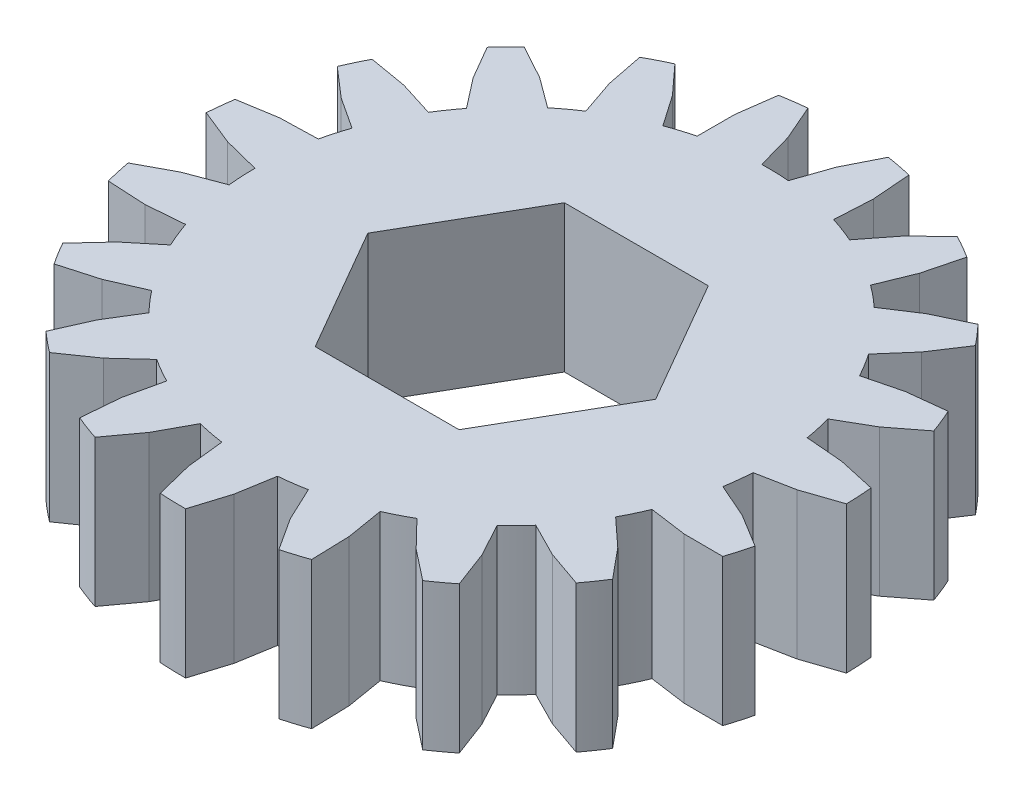
from build123d import *

# Parameters (mm, degrees)
BOSS_EXTRUDE1_DEPTH      = 2.5
BOSS_EXTRUDE1_DEPTH_BACK = 2.5
SKETCH3_R                = 11.25
CUT_EXTRUDE1_DEPTH       = 17.105123408
CUT_EXTRUDE1_DEPTH_BACK  = 17.105123408
CUT_EXTRUDE2_DEPTH       = 17.676263216


with BuildPart() as part:
    # Sketch3 → Boss-Extrude1 (new, two sides: drawn at the far end of the back side and taken through both)
    with BuildSketch(Plane(origin=(0, 0, 0), x_dir=(1, 0, 0), z_dir=(0, 1, 0)).offset(-BOSS_EXTRUDE1_DEPTH_BACK)):
        Circle(SKETCH3_R)
    extrude(amount=BOSS_EXTRUDE1_DEPTH + BOSS_EXTRUDE1_DEPTH_BACK)

    # Sketch1 → Cut-Extrude1 (cut, two sides: drawn at the far end of the back side and taken through both)
    with BuildSketch(Plane(origin=(0, 0, 0), x_dir=(1, 0, 0), z_dir=(0, 1, 0)).offset(-CUT_EXTRUDE1_DEPTH_BACK)):
        with BuildLine():
            Line((1.131858911, 9.935738292), (0.713336296, 8.720874459))
            ThreePointArc((0.713336296, 8.720874459), (0.24791183, 8.746487279), (-0.218216182, 8.747278531))
            Line((-0.218216182, 8.747278531), (-0.567253557, 9.983898207))
            Line((-0.567253557, 9.983898207), (-1.093414937, 11.196738086))
            ThreePointArc((-1.093414937, 11.196738086), (0.318743782, 11.245483645), (1.725874204, 11.116827705))
            Line((1.725874204, 11.116827705), (1.131858911, 9.935738292))
        make_face()
        with BuildLine():
            Line((4.296660623, 9.029878598), (3.506349076, 8.016733509))
            ThreePointArc((3.506349076, 8.016733509), (3.074459061, 8.192081633), (2.633844069, 8.344181531))
            Line((2.633844069, 8.344181531), (2.705248253, 9.627129992))
            Line((2.705248253, 9.627129992), (2.601404214, 10.945099182))
            ThreePointArc((2.601404214, 10.945099182), (3.952875935, 10.532676386), (5.241989634, 9.954096879))
            Line((5.241989634, 9.954096879), (4.296660623, 9.029878598))
        make_face()
        with BuildLine():
            Line((6.995852487, 7.145491445), (5.919394526, 6.443855092))
            ThreePointArc((5.919394526, 6.443855092), (5.567840946, 6.749936829), (5.200486446, 7.036862989))
            Line((5.200486446, 7.036862989), (5.684594439, 8.227112863))
            Line((5.684594439, 8.227112863), (6.014320853, 9.507388951))
            ThreePointArc((6.014320853, 9.507388951), (7.158652645, 8.678490209), (8.19005415, 7.712685202))
            Line((8.19005415, 7.712685202), (6.995852487, 7.145491445))
        make_face()
        with BuildLine():
            Line((8.936935181, 4.48677942), (7.690981731, 4.172684988))
            ThreePointArc((7.690981731, 4.172684988), (7.457860872, 4.576331633), (7.203575423, 4.966991153))
            Line((7.203575423, 4.966991153), (8.047926613, 5.935560398))
            Line((8.047926613, 5.935560398), (8.775492506, 7.039405605))
            ThreePointArc((8.775492506, 7.039405605), (9.588678264, 5.883854957), (10.250599217, 4.635484408))
            Line((10.250599217, 4.635484408), (8.936935181, 4.48677942))
        make_face()
        with BuildLine():
            Line((9.909562279, 1.341855225), (8.629131728, 1.44933972))
            ThreePointArc((8.629131728, 1.44933972), (8.539705851, 1.906809896), (8.426045228, 2.358868756))
            Line((8.426045228, 2.358868756), (9.539141061, 3.000797864))
            Line((9.539141061, 3.000797864), (10.58570338, 3.808593434))
            ThreePointArc((10.58570338, 3.808593434), (10.979621808, 2.451612724), (11.200332804, 1.055956952))
            Line((11.200332804, 1.055956952), (9.909562279, 1.341855225))
        make_face()
        with BuildLine():
            Line((9.80833454, -1.948479804), (8.632181407, -1.431063996))
            ThreePointArc((8.632181407, -1.431063996), (8.696141194, -0.96934428), (8.735422289, -0.504873673))
            Line((8.735422289, -0.504873673), (9.99664156, -0.25914768))
            Line((9.99664156, -0.25914768), (11.248789039, 0.165061068))
            ThreePointArc((11.248789039, 0.165061068), (11.180752964, -1.246299789), (10.936336541, -2.637999824))
            Line((10.936336541, -2.637999824), (9.80833454, -1.948479804))
        make_face()
        with BuildLine():
            Line((8.644221562, -5.027666813), (7.699800288, -4.156389722))
            ThreePointArc((7.699800288, -4.156389722), (7.910214704, -3.740454963), (8.098180801, -3.313905205))
            Line((8.098180801, -3.313905205), (9.370850832, -3.491010552))
            Line((9.370850832, -3.491010552), (10.692893862, -3.496358227))
            ThreePointArc((10.692893862, -3.496358227), (10.170276048, -4.809156382), (9.487218518, -6.046088387))
            Line((9.487218518, -6.046088387), (8.644221562, -5.027666813))
        make_face()
        with BuildLine():
            Line((6.543373049, -7.56202811), (5.933026334, -6.431306129))
            ThreePointArc((5.933026334, -6.431306129), (6.267093712, -6.106229312), (6.583375767, -5.763823688))
            Line((6.583375767, -5.763823688), (7.729583013, -6.344568263))
            Line((7.729583013, -6.344568263), (8.978257718, -6.778892855))
            ThreePointArc((8.978257718, -6.778892855), (8.057691915, -7.850866258), (7.01001316, -8.798989458))
            Line((7.01001316, -8.798989458), (6.543373049, -7.56202811))
        make_face()
        with BuildLine():
            Line((3.733448535, -9.276926325), (3.523316916, -8.009290725))
            ThreePointArc((3.523316916, -8.009290725), (3.944835871, -7.810298967), (4.355159817, -7.58914244))
            Line((4.355159817, -7.58914244), (5.250694938, -8.510593556))
            Line((5.250694938, -8.510593556), (6.290688039, -9.326829258))
            ThreePointArc((6.290688039, -9.326829258), (5.071931835, -10.041812957), (3.773164105, -10.598383492))
            Line((3.773164105, -10.598383492), (3.733448535, -9.276926325))
        make_face()
        with BuildLine():
            Line((0.518946942, -9.986525626), (0.73180144, -8.719344394))
            ThreePointArc((0.73180144, -8.719344394), (1.195093854, -8.668001539), (1.654994723, -8.59205985))
            Line((1.654994723, -8.59205985), (2.202812593, -9.754363981))
            Line((2.202812593, -9.754363981), (2.9214247, -10.864058989))
            ThreePointArc((2.9214247, -10.864058989), (1.536549241, -11.144573407), (0.127434172, -11.249278223))
            Line((0.127434172, -11.249278223), (0.518946942, -9.986525626))
        make_face()
        with BuildLine():
            Line((-2.751790604, -9.613929918), (-2.139016077, -8.484521803))
            ThreePointArc((-2.139016077, -8.484521803), (-1.684155126, -8.586391647), (-1.224514728, -8.663894256))
            Line((-1.224514728, -8.663894256), (-1.083778676, -9.941097715))
            Line((-1.083778676, -9.941097715), (-0.764420336, -11.223999356))
            ThreePointArc((-0.764420336, -11.223999356), (-2.165342305, -11.039646403), (-3.532105231, -10.681139108))
            Line((-3.532105231, -10.681139108), (-2.751790604, -9.613929918))
        make_face()
        with BuildLine():
            Line((-5.72432894, -8.199515729), (-4.778038012, -7.330269624))
            ThreePointArc((-4.778038012, -7.330269624), (-4.380899766, -7.574312988), (-3.971329009, -7.796861285))
            Line((-3.971329009, -7.796861285), (-4.25292571, -9.050559259))
            Line((-4.25292571, -9.050559259), (-4.367428567, -10.367645235))
            ThreePointArc((-4.367428567, -10.367645235), (-5.632585414, -9.738402413), (-6.808886226, -8.955532836))
            Line((-6.808886226, -8.955532836), (-5.72432894, -8.199515729))
        make_face()
        with BuildLine():
            Line((-8.076547414, -5.896556781), (-6.899285389, -5.38166899))
            ThreePointArc((-6.899285389, -5.38166899), (-6.60290594, -5.741439989), (-6.28778817, -6.084917413))
            Line((-6.28778817, -6.084917413), (-6.961202251, -7.179252274))
            Line((-6.961202251, -7.179252274), (-7.497158145, -8.387795881))
            ThreePointArc((-7.497158145, -8.387795881), (-8.489450494, -7.381851415), (-9.347818747, -6.259455621))
            Line((-9.347818747, -6.259455621), (-8.076547414, -5.896556781))
        make_face()
        with BuildLine():
            Line((-9.553546654, -2.954614412), (-8.272888141, -2.849881016))
            ThreePointArc((-8.272888141, -2.849881016), (-8.1093848, -3.28639288), (-7.922867918, -3.713578323))
            Line((-7.922867918, -3.713578323), (-8.915124515, -4.529961907))
            Line((-8.915124515, -4.529961907), (-9.814454308, -5.498998694))
            ThreePointArc((-9.814454308, -5.498998694), (-10.426351886, -4.225362275), (-10.873770061, -2.885069265))
            Line((-10.873770061, -2.885069265), (-9.553546654, -2.954614412))
        make_face()
        with BuildLine():
            Line((-9.995270876, 0.307506274), (-8.749995096, -0.009264214))
            ThreePointArc((-8.749995096, -0.009264214), (-8.737085987, -0.475214109), (-8.69938199, -0.939815399))
            Line((-8.69938199, -0.939815399), (-9.902954705, -1.389779878))
            Line((-9.902954705, -1.389779878), (-11.068202059, -2.014299673))
            ThreePointArc((-11.068202059, -2.014299673), (-11.233396269, -0.610989569), (-11.221379665, 0.801959113))
            Line((-11.221379665, 0.801959113), (-9.995270876, 0.307506274))
        make_face()
        with BuildLine():
            Line((-9.353852406, 3.536303884), (-8.278904312, 2.83235651))
            ThreePointArc((-8.278904312, 2.83235651), (-8.417988338, 2.387461485), (-8.53318304, 1.935791107))
            Line((-8.53318304, 1.935791107), (-9.817646093, 1.901006365))
            Line((-9.817646093, 1.901006365), (-11.122538377, 1.688679973))
            ThreePointArc((-11.122538377, 1.688679973), (-10.823127863, 3.069593338), (-10.352978664, 4.402082777))
            Line((-10.352978664, 4.402082777), (-9.353852406, 3.536303884))
        make_face()
        with BuildLine():
            Line((-7.698798888, 6.381888097), (-6.910665785, 5.367047457))
            ThreePointArc((-6.910665785, 5.367047457), (-7.186671034, 4.991418581), (-7.442281301, 4.601624609))
            Line((-7.442281301, 4.601624609), (-8.668443189, 4.985789072))
            Line((-8.668443189, 4.985789072), (-9.971575077, 5.208664942))
            ThreePointArc((-9.971575077, 5.208664942), (-9.240005615, 6.417538176), (-8.362671783, 7.525172467))
            Line((-8.362671783, 7.525172467), (-7.698798888, 6.381888097))
        make_face()
        with BuildLine():
            Line((-5.209461051, 8.535895709), (-4.79354939, 7.320135534))
            ThreePointArc((-4.79354939, 7.320135534), (-5.17656641, 7.054478025), (-5.544892904, 6.768800683))
            Line((-5.544892904, 6.768800683), (-6.579879962, 7.53028417))
            Line((-6.579879962, 7.53028417), (-7.740036893, 8.164210243))
            ThreePointArc((-7.740036893, 8.164210243), (-6.655585384, 9.070043175), (-5.466139653, 9.832792955))
            Line((-5.466139653, 9.832792955), (-5.209461051, 8.535895709))
        make_face()
        with BuildLine():
            Line((-2.155597276, 9.764906573), (-2.15697754, 8.479973343))
            ThreePointArc((-2.15697754, 8.479973343), (-2.605500493, 8.353075313), (-3.046629323, 8.202472174))
            Line((-3.046629323, 8.202472174), (-3.778284643, 9.258756134))
            Line((-3.778284643, 9.258756134), (-4.669745613, 10.235036683))
            ThreePointArc((-4.669745613, 10.235036683), (-3.349929206, 10.739668259), (-1.977266476, 11.074877755))
            Line((-1.977266476, 11.074877755), (-2.155597276, 9.764906573))
        make_face()
    extrude(amount=CUT_EXTRUDE1_DEPTH + CUT_EXTRUDE1_DEPTH_BACK, mode=Mode.SUBTRACT)

    # Sketch4 → Cut-Extrude2 (cut, through all)
    with BuildSketch(Plane(origin=(0, 2.5, 0), x_dir=(1, 0, 0), z_dir=(0, 1, 0))):
        Polygon((4.907477288, 0), (2.453738644, 4.25), (-2.453738644, 4.25), (-4.907477288, 0), (-2.453738644, -4.25), (2.453738644, -4.25), align=None)
    extrude(amount=-CUT_EXTRUDE2_DEPTH, mode=Mode.SUBTRACT)


solid = part.part
